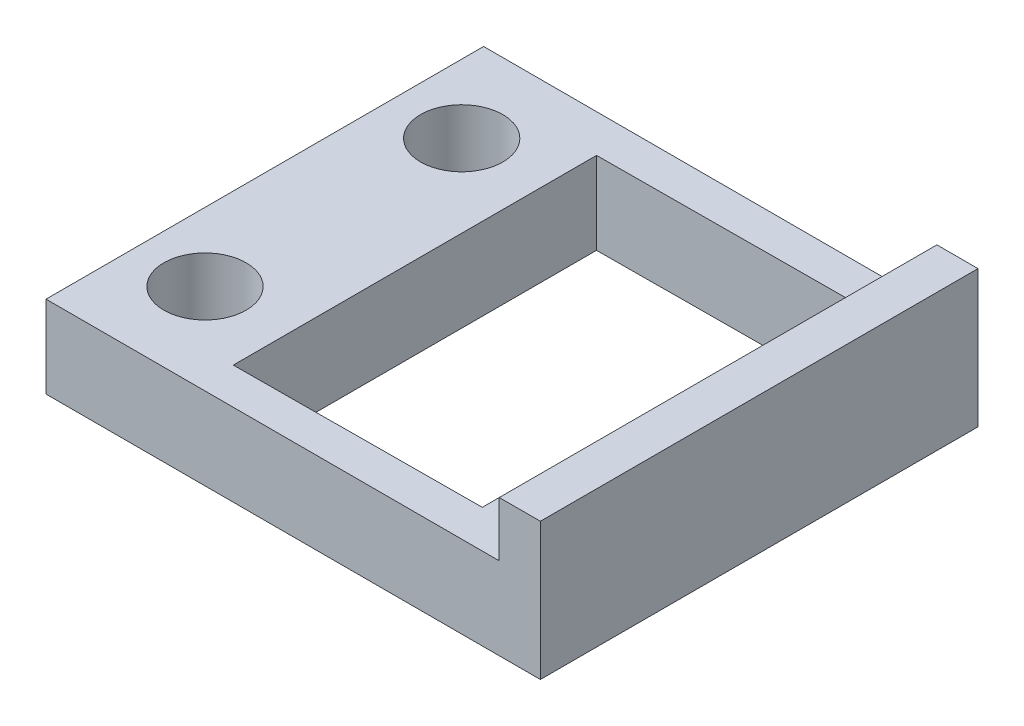
from build123d import *

# Parameters (mm, degrees)
SKETCH1_R           = 1.5
BOSS_EXTRUDE1_DEPTH = 3
SKETCH2_W           = 1.5
SKETCH2_H           = 15.964561632
BOSS_EXTRUDE2_DEPTH = 5


with BuildPart() as part:
    # Sketch1 → Boss-Extrude1 (new body)
    with BuildSketch(Plane(origin=(0, 0, 0), x_dir=(1, 0, 0), z_dir=(0, 1, 0))):
        Polygon((-8.266979, 7.982280816), (-8.266979, -7.982280816), (-3.266979, -7.982280816), (8.266979, -7.982280816), (8.266979, -6.599979816), (8.266979, 6.600020184), (8.266979, 7.982280816), (-3.266979, 7.982280816), align=None)
        with Locations(Location((-5.766979, 4.682321184, 0), (0, 0, 270))):
            Circle(SKETCH1_R, mode=Mode.SUBTRACT)
        with Locations(Location((-5.766979, -4.682280816, 0), (0, 0, 270))):
            Circle(SKETCH1_R, mode=Mode.SUBTRACT)
        Polygon((-2.766979, -6.649979816), (-2.766979, 6.600020184), (6.266979, 6.650020184), (6.266979, -6.599979816), align=None, mode=Mode.SUBTRACT)
    extrude(amount=BOSS_EXTRUDE1_DEPTH)

    # Sketch2 → Boss-Extrude2 (add)
    with BuildSketch(Plane(origin=(0, 0, 0), x_dir=(1, 0, 0), z_dir=(0, 1, 0))):
        with Locations((9.016979, 0)):
            Rectangle(SKETCH2_W, SKETCH2_H)
    extrude(amount=BOSS_EXTRUDE2_DEPTH)


solid = part.part
